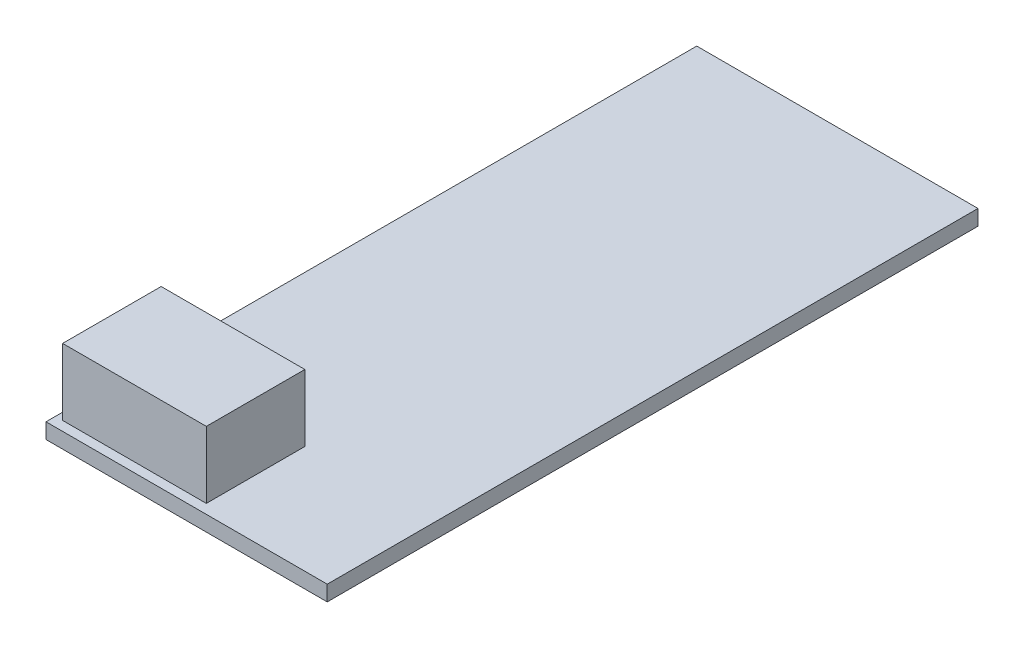
from build123d import *

# Parameters (mm, degrees)
SKETCH1_W           = 27.4
SKETCH1_H           = 63.4
BOSS_EXTRUDE1_DEPTH = 1.5
SKETCH2_W           = 14
SKETCH2_H           = 9.6
BOSS_EXTRUDE2_DEPTH = 6.5


with BuildPart() as part:
    # Sketch1 → Boss-Extrude1 (new body)
    with BuildSketch(Plane(origin=(0, 0, 0), x_dir=(1, 0, 0), z_dir=(0, 1, 0))):
        Rectangle(SKETCH1_W, SKETCH1_H)
    extrude(amount=BOSS_EXTRUDE1_DEPTH)

    # Sketch2 → Boss-Extrude2 (add)
    with BuildSketch(Plane(origin=(0, 1.5, 0), x_dir=(1, 0, 0), z_dir=(0, 1, 0))):
        with Locations((-6.004461179, -25.976122384)):
            Rectangle(SKETCH2_W, SKETCH2_H)
    extrude(amount=BOSS_EXTRUDE2_DEPTH)


solid = part.part
